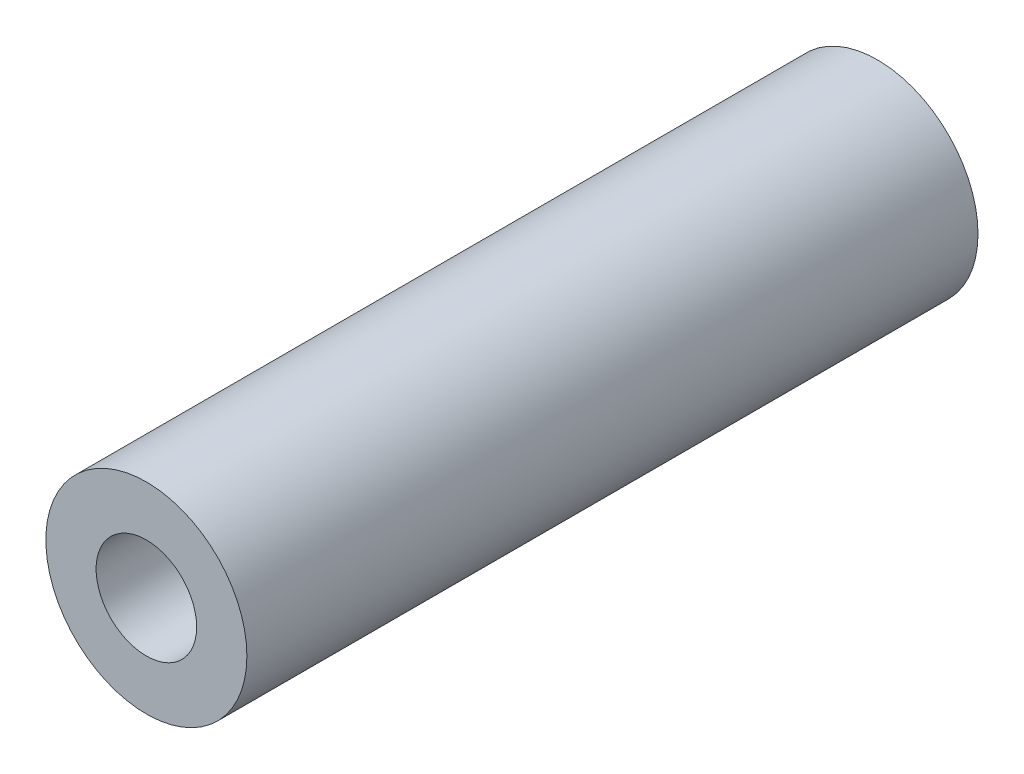
from build123d import *

# Parameters (mm, degrees)
SKETCH1_R           = 11
SKETCH1_R_2         = 5.5
BOSS_EXTRUDE1_DEPTH = 80


with BuildPart() as part:
    # Sketch1 → Boss-Extrude1 (new body)
    with BuildSketch(Plane.XY):
        Circle(SKETCH1_R)
        Circle(SKETCH1_R_2, mode=Mode.SUBTRACT)
    extrude(amount=BOSS_EXTRUDE1_DEPTH)


solid = part.part
